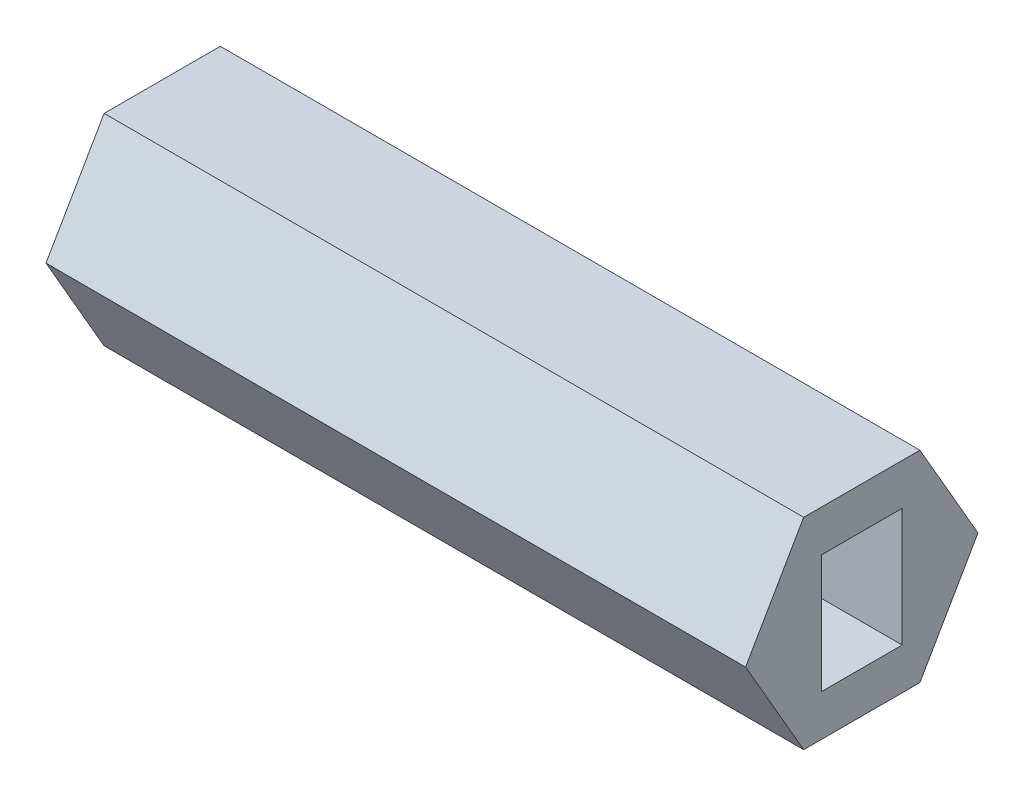
from build123d import *

# Parameters (mm, degrees)
SKETCH1_W           = 3.81
SKETCH1_H           = 5.588
BOSS_EXTRUDE1_DEPTH = 33.02


with BuildPart() as part:
    # Sketch1 → Boss-Extrude1 (new body)
    with BuildSketch(Plane(origin=(0, 0, 0), x_dir=(0, 0, -1), z_dir=(1, 0, 0))):
        Polygon((-2.742413779, 4.75), (-5.484827557, 0), (-2.742413779, -4.75), (2.742413779, -4.75), (5.484827557, 0), (2.742413779, 4.75), align=None)
        Rectangle(SKETCH1_W, SKETCH1_H, mode=Mode.SUBTRACT)
    extrude(amount=BOSS_EXTRUDE1_DEPTH)


solid = part.part
